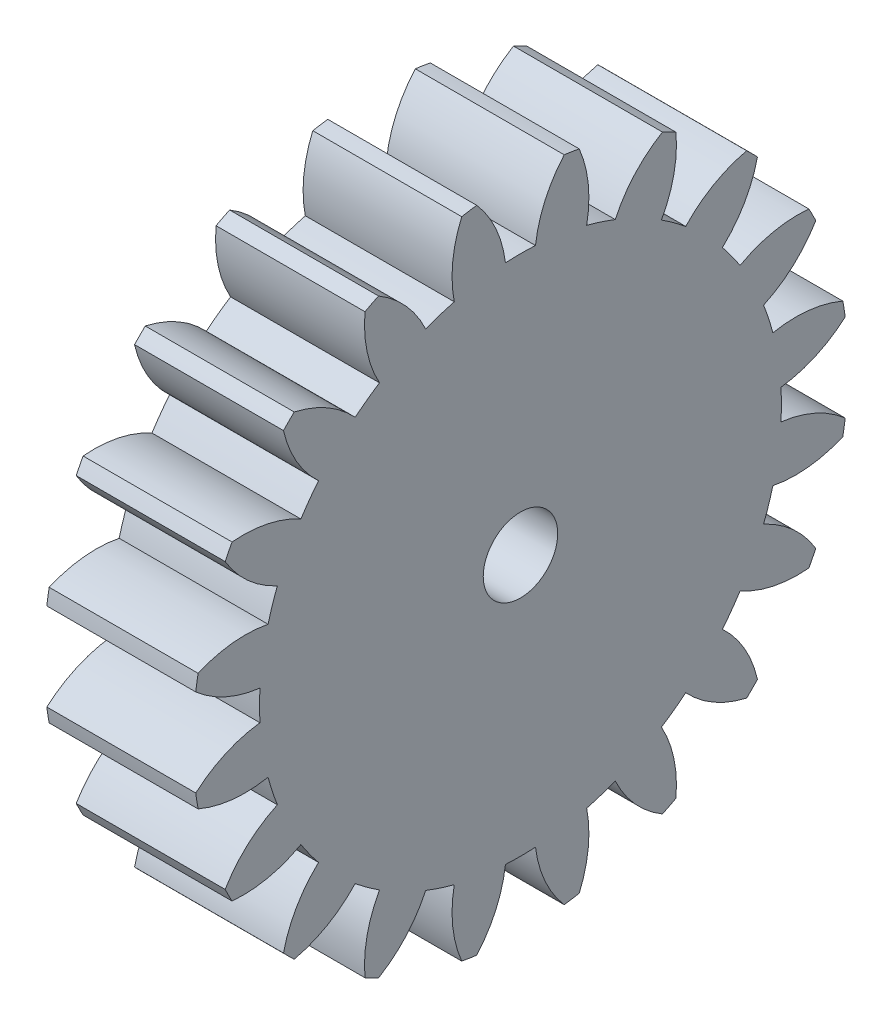
from build123d import *

# Parameters (mm, degrees)
BASPROSKE_W     = 6.35
BASPROSKE_H     = 13.97
TOOTHCUT_DEPTH  = 21.751970991
TEETHCUTS_COUNT = 20
TEETHCUTS_ANGLE = 342
BORSKE_R        = 1.5875
BORE_DEPTH      = 50.8000508


with BuildPart() as part:
    # BasProSke → Base-Revolve (revolve)
    with BuildSketch(Plane(origin=(0, 0, 0), x_dir=(1, 0, 0), z_dir=(0, 1, 0)), mode=Mode.PRIVATE) as base_revolve_sk:
        with Locations((3.175, 6.985)):
            Rectangle(BASPROSKE_W, BASPROSKE_H)
    revolve(base_revolve_sk.sketch.rotate(Axis((-10, 0, 0), (1, 0, 0)), 180), axis=Axis((-10, 0, 0), (1, 0, 0)))

    # TooCutSke → ToothCut (cut, through all)
    with BuildSketch(Plane(origin=(0, 0, 0), x_dir=(0, 0, -1), z_dir=(1, 0, 0))):
        with BuildLine():
            ThreePointArc((0.64046545, 11.106749257), (0, 11.1252), (-0.64046545, 11.106749257))
            ThreePointArc((-0.64046545, 11.106749257), (-1.052455812, 12.582227662), (-1.8855699, 13.867798935))
            ThreePointArc((-1.8855699, 13.867798935), (0, 13.9954), (1.8855699, 13.867798935))
            ThreePointArc((1.8855699, 13.867798935), (1.052455812, 12.582227662), (0.64046545, 11.106749257))
        make_face()
    toothcut = extrude(amount=TOOTHCUT_DEPTH, mode=Mode.SUBTRACT)

    # TeethCuts: ToothCut ×20 about axis
    teethcuts_axis = Axis((-10, 0, 0), (1, 0, 0))
    for i in range(1, TEETHCUTS_COUNT):
        add(toothcut.rotate(teethcuts_axis, i * TEETHCUTS_ANGLE / (TEETHCUTS_COUNT - 1)), mode=Mode.SUBTRACT)

    # BorSke → Bore (cut, symmetric)
    with BuildSketch(Plane(origin=(0, 0, 0), x_dir=(0, 0, -1), z_dir=(1, 0, 0))):
        with Locations(Location((0, 0, 0), (0, 0, 180))):
            Circle(BORSKE_R)
    extrude(amount=BORE_DEPTH, both=True, mode=Mode.SUBTRACT)


solid = part.part
